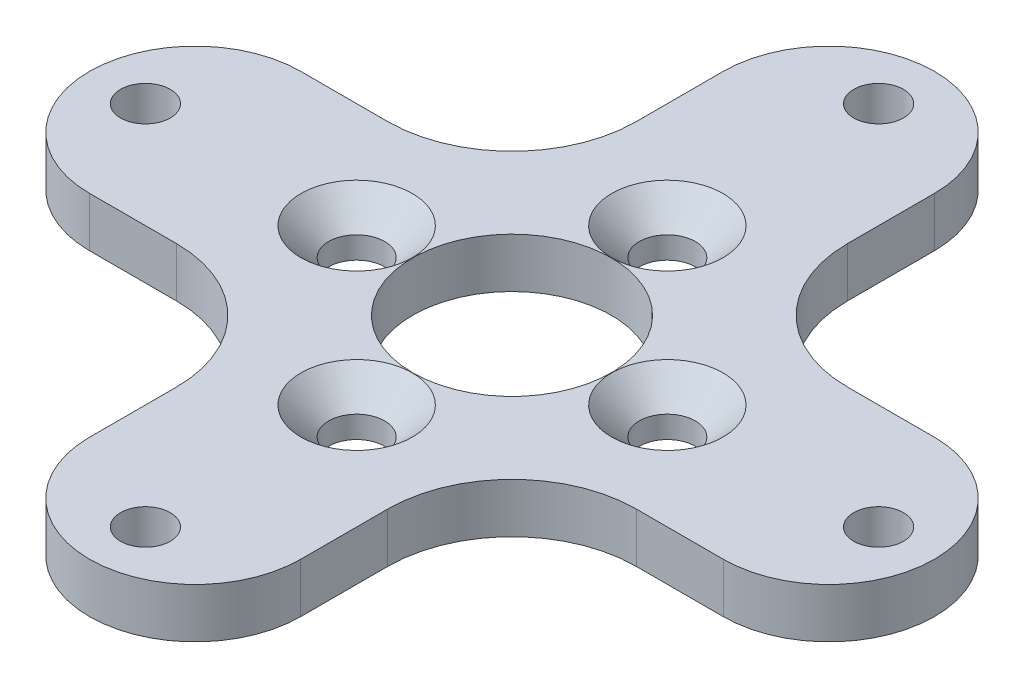
from build123d import *

# Parameters (mm, degrees)
ESBO_O1_W                           = 17
ESBO_O1_H                           = 17
RESSALTO_EXTRUS_O1_DEPTH            = 2
FILETE1_R                           = 10
ESBO_O3_R                           = 8
ESBO_O3_R_2                         = 2
CORTE_EXTRUS_O1_DEPTH               = 49.249352327
PADR_OCIRCULAR1_COUNT               = 4
ESCAREADO_PARA_SFHCS_M41_AT_2_COUNT = 2
ESCAREADO_PARA_SFHCS_M41_AT_2_PITCH = 17.67766953
ESCAREADO_PARA_SFHCS_M41_AT_3_COUNT = 2
ESCAREADO_PARA_SFHCS_M41_AT_3_PITCH = 25
ESCAREADO_PARA_SFHCS_M41_AT_4_COUNT = 2
ESCAREADO_PARA_SFHCS_M41_AT_4_PITCH = 17.67766953


with BuildPart() as part:
    # Esboço1 → Ressalto-extrusão1 (new, symmetric)
    with BuildSketch(Plane(origin=(0, 0, 0), x_dir=(1, 0, 0), z_dir=(0, 1, 0))):
        with BuildLine():
            Line((-8.5, -8.5), (-8.5, 8.5))
            Line((-8.5, 8.5), (-25.5, 8.5))
            ThreePointArc((-25.5, 8.5), (-34, 0), (-25.5, -8.5))
            Line((-25.5, -8.5), (-8.5, -8.5))
        make_face()
        with BuildLine():
            Line((8.5, 8.5), (8.5, 25.5))
            ThreePointArc((8.5, 25.5), (0, 34), (-8.5, 25.5))
            Line((-8.5, 25.5), (-8.5, 8.5))
            Line((-8.5, 8.5), (8.5, 8.5))
        make_face()
        Rectangle(ESBO_O1_W, ESBO_O1_H)
        with BuildLine():
            Line((25.5, 8.5), (8.5, 8.5))
            Line((8.5, 8.5), (8.5, -8.5))
            Line((8.5, -8.5), (25.5, -8.5))
            ThreePointArc((25.5, -8.5), (34, 0), (25.5, 8.5))
        make_face()
        with BuildLine():
            Line((8.5, -25.5), (8.5, -8.5))
            Line((8.5, -8.5), (-8.5, -8.5))
            Line((-8.5, -8.5), (-8.5, -25.5))
            ThreePointArc((-8.5, -25.5), (0, -34), (8.5, -25.5))
        make_face()
    extrude(amount=RESSALTO_EXTRUS_O1_DEPTH, both=True)

    # Filete1
    filete1_edges = [part.edges().sort_by_distance(p)[0] for p in [
        (-8.5, 0, -8.5),
        (8.5, 0, -8.5),
        (8.5, 0, 8.5),
        (-8.5, 0, 8.5),
    ]]
    fillet(filete1_edges, radius=FILETE1_R)

    # Esboço3 → Corte-extrusão1 (cut, through all)
    with BuildSketch(Plane(origin=(0, 2, 0), x_dir=(1, 0, 0), z_dir=(0, 1, 0))):
        with Locations(Location((0, 0, 0), (0, 0, 270))):
            Circle(ESBO_O3_R)
        with Locations(Location((0, 29.5, 0), (0, 0, 270))):
            Circle(ESBO_O3_R_2)
    corte_extrus_o1 = extrude(amount=-CORTE_EXTRUS_O1_DEPTH, mode=Mode.SUBTRACT)

    # PadrãoCircular1: Corte-extrusão1 ×4 about axis
    padr_ocircular1_axis = Axis((0, 0, 0), (0, 1, 0))
    for i in range(1, PADR_OCIRCULAR1_COUNT):
        add(corte_extrus_o1.rotate(padr_ocircular1_axis, i * 360 / PADR_OCIRCULAR1_COUNT), mode=Mode.SUBTRACT)

    # Esboço6 → Escareado para SFHCS M41 (revolve, cut)
    with BuildSketch(Plane(origin=(-12.5, 2, 0), x_dir=(0, 0, 1), z_dir=(1, 0, 0))):
        Polygon((0, 0), (0, 4), (2.25, 4), (2.25, 2.23), (4.48, 0), align=None)
    escareado_para_sfhcs_m41 = revolve(axis=Axis((-12.5, 8.35, 0), (0, -1, 0)), mode=Mode.SUBTRACT)

    # Escareado para SFHCS M41 at 2: Escareado para SFHCS M41 ×2
    with Locations(*[Vector(0.7071067811865476, 0, -0.7071067811865476) * (i * ESCAREADO_PARA_SFHCS_M41_AT_2_PITCH) for i in range(1, ESCAREADO_PARA_SFHCS_M41_AT_2_COUNT)]):
        add(escareado_para_sfhcs_m41, mode=Mode.SUBTRACT)

    # Escareado para SFHCS M41 at 3: Escareado para SFHCS M41 ×2
    with Locations(*[(i * ESCAREADO_PARA_SFHCS_M41_AT_3_PITCH, 0, 0) for i in range(1, ESCAREADO_PARA_SFHCS_M41_AT_3_COUNT)]):
        add(escareado_para_sfhcs_m41, mode=Mode.SUBTRACT)

    # Escareado para SFHCS M41 at 4: Escareado para SFHCS M41 ×2
    with Locations(*[Vector(0.7071067811865476, 0, 0.7071067811865476) * (i * ESCAREADO_PARA_SFHCS_M41_AT_4_PITCH) for i in range(1, ESCAREADO_PARA_SFHCS_M41_AT_4_COUNT)]):
        add(escareado_para_sfhcs_m41, mode=Mode.SUBTRACT)


solid = part.part
